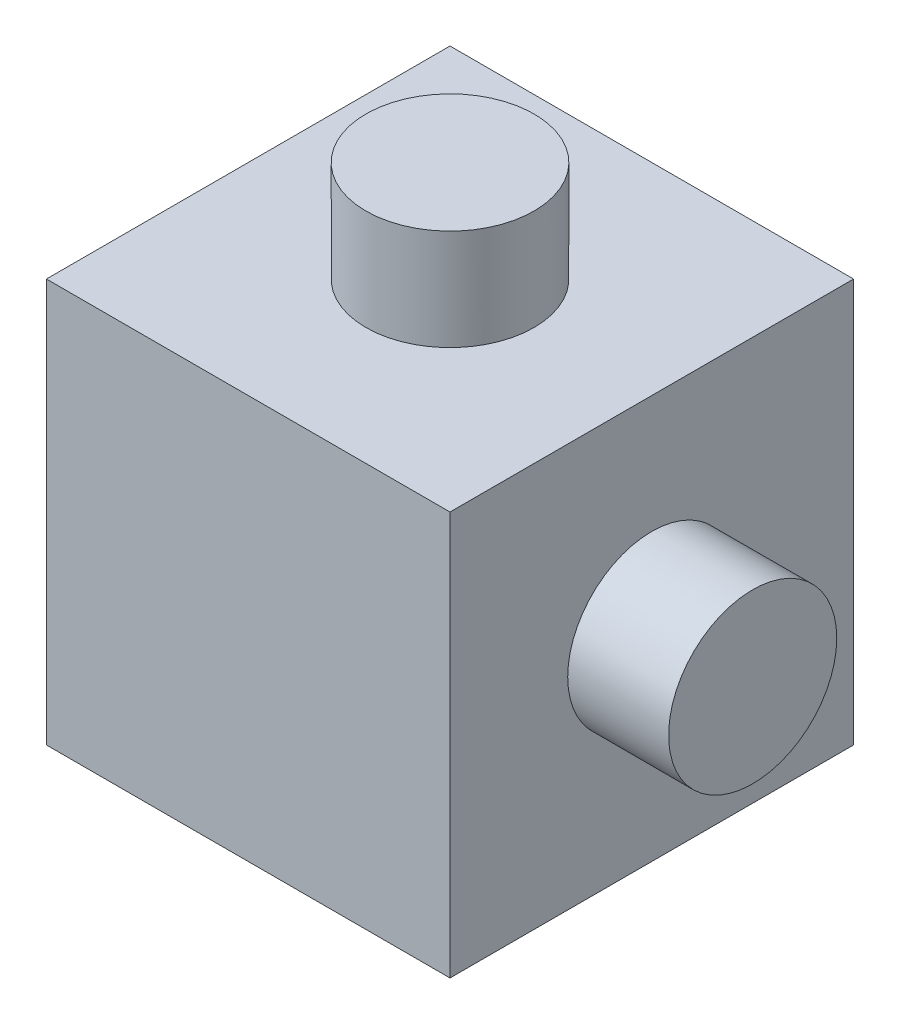
from build123d import *

# Parameters (mm, degrees)
SKETCH_1_W           = 12
SKETCH_1_H           = 12
EXTRUDE_1_DEPTH      = 12
EXTRUDE_2_DEPTH      = 3
EXTRUDE_2_DEPTH_BACK = 15
SKETCH_2_R           = 2.5
EXTRUDE_3_DEPTH      = 3
EXTRUDE_3_DEPTH_BACK = 15
SKETCH_3_R           = 2.5


with BuildPart() as part:
    # 草图1 → 凸台-拉伸1 (new body)
    with BuildSketch(Plane(origin=(0, 0, 0), x_dir=(1, 0, 0), z_dir=(0, 1, 0))):
        Rectangle(SKETCH_1_W, SKETCH_1_H)
    extrude(amount=EXTRUDE_1_DEPTH)

    # 草图2 → 凸台-拉伸2 (add, two sides: drawn at the far end of the back side and taken through both)
    with BuildSketch(Plane(origin=(0, 12, 0), x_dir=(1, 0, 0), z_dir=(0, 1, 0)).offset(-EXTRUDE_2_DEPTH_BACK)):
        with Locations(Location((0, 0, 0), (0, 0, 270))):
            Circle(SKETCH_2_R)
    extrude(amount=EXTRUDE_2_DEPTH + EXTRUDE_2_DEPTH_BACK)

    # 草图3 → 凸台-拉伸3 (add, two sides: drawn at the far end of the back side and taken through both)
    with BuildSketch(Plane(origin=(6, 0, 0), x_dir=(0, 0, -1), z_dir=(1, 0, 0)).offset(-EXTRUDE_3_DEPTH_BACK)):
        with Locations((0, 6)):
            Circle(SKETCH_3_R)
    extrude(amount=EXTRUDE_3_DEPTH + EXTRUDE_3_DEPTH_BACK)


solid = part.part
